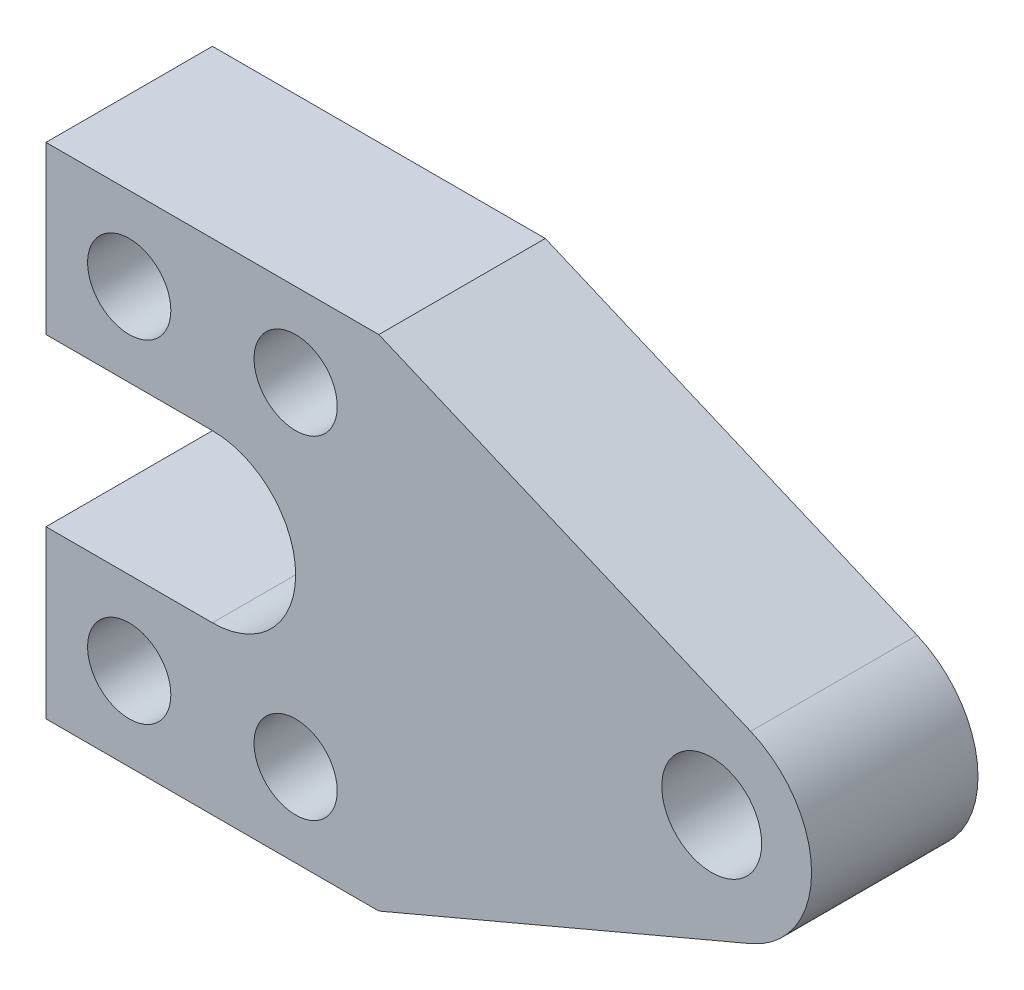
from build123d import *

# Parameters (mm, degrees)
SKETCH1_R           = 5
SKETCH1_R_2         = 6
BOSS_EXTRUDE1_DEPTH = 20


with BuildPart() as part:
    # Sketch1 → Boss-Extrude1 (new body)
    with BuildSketch(Plane.XY):
        with BuildLine():
            Line((10, 10), (50, 10))
            Line((50, 10), (94.685564793, 28.952580276))
            ThreePointArc((94.685564793, 28.952580276), (102, 40), (94.685564793, 51.047419724))
            Line((94.685564793, 51.047419724), (50, 70))
            Line((50, 70), (10, 70))
            Line((10, 70), (10, 50))
            Line((10, 50), (30, 50))
            ThreePointArc((30, 50), (40, 40), (30, 30))
            Line((30, 30), (10, 30))
            Line((10, 30), (10, 10))
        make_face()
        with Locations((20, 60)):
            Circle(SKETCH1_R, mode=Mode.SUBTRACT)
        with Locations((40, 60)):
            Circle(SKETCH1_R, mode=Mode.SUBTRACT)
        with Locations((20, 20)):
            Circle(SKETCH1_R, mode=Mode.SUBTRACT)
        with Locations((40, 20)):
            Circle(SKETCH1_R, mode=Mode.SUBTRACT)
        with Locations((90, 40)):
            Circle(SKETCH1_R_2, mode=Mode.SUBTRACT)
    extrude(amount=BOSS_EXTRUDE1_DEPTH)


solid = part.part
